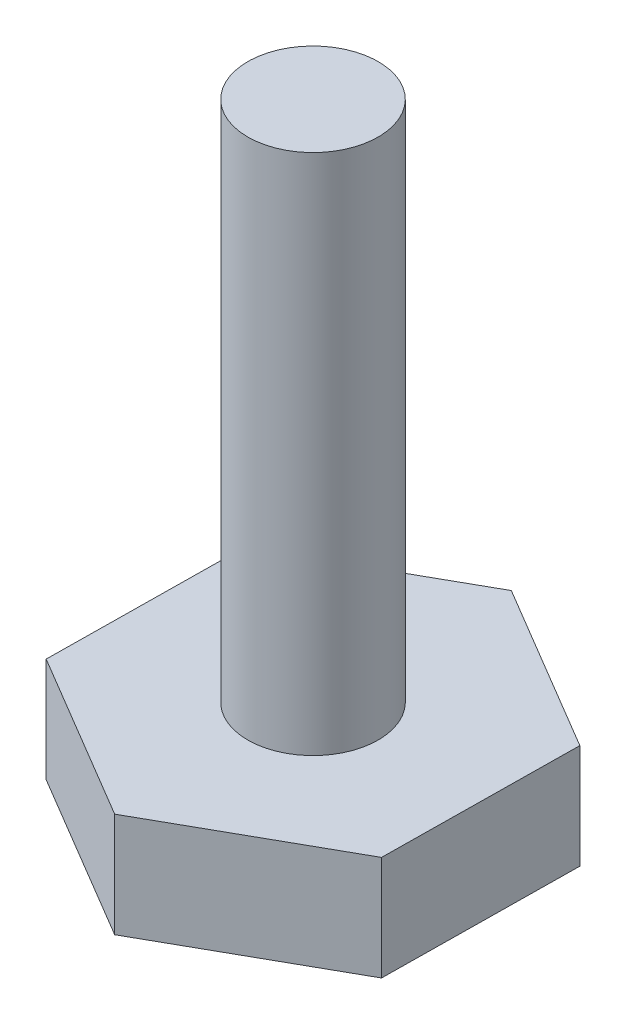
from build123d import *

# Parameters (mm, degrees)
BOSS_EXTRUDE1_DEPTH = 4
SKETCH2_R           = 2.5
BOSS_EXTRUDE2_DEPTH = 20


with BuildPart() as part:
    # Sketch1 → Boss-Extrude1 (new body)
    with BuildSketch(Plane(origin=(0, 0, 0), x_dir=(1, 0, 0), z_dir=(0, 1, 0))):
        Polygon((6.454752386, -3.830078976), (6.544321885, 3.674940054), (0.089569499, 7.50501903), (-6.454752386, 3.830078976), (-6.544321885, -3.674940054), (-0.089569499, -7.50501903), align=None)
    extrude(amount=BOSS_EXTRUDE1_DEPTH)

    # Sketch2 → Boss-Extrude2 (add)
    with BuildSketch(Plane(origin=(0, 4, 0), x_dir=(1, 0, 0), z_dir=(0, 1, 0))):
        with Locations(Location((0, 0, 0), (0, 0, 270))):
            Circle(SKETCH2_R)
    extrude(amount=BOSS_EXTRUDE2_DEPTH)


solid = part.part
